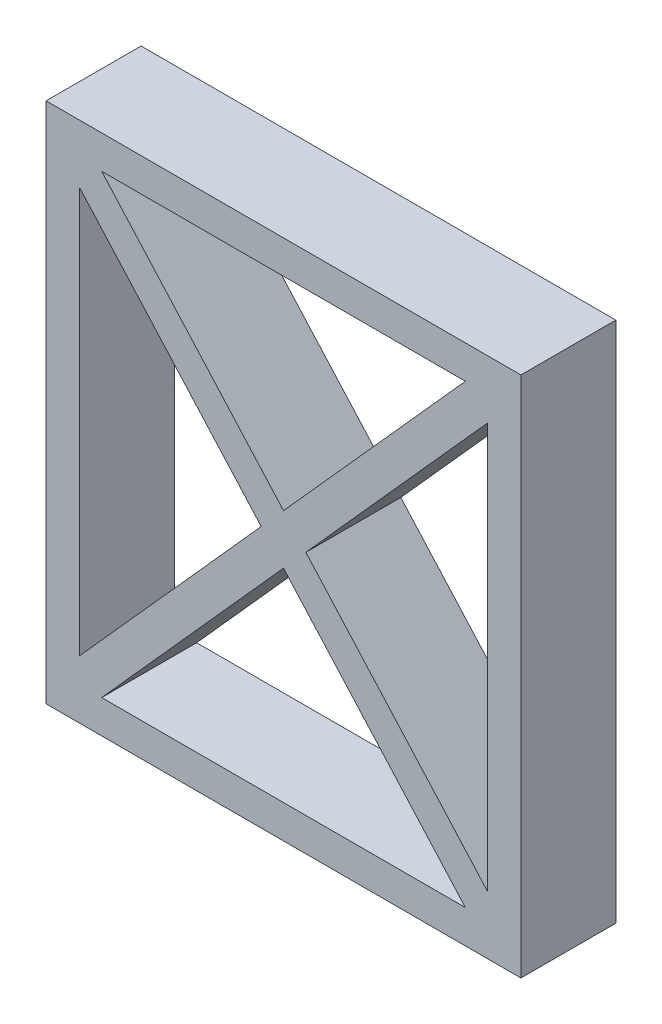
from build123d import *

# Parameters (mm, degrees)
SKIZZE1_W                       = 100
SKIZZE1_H                       = 110
AUFSATZ_LINEAR_AUSTRAGEN1_DEPTH = 20


with BuildPart() as part:
    # Skizze1 → Aufsatz-Linear austragen1 (new body)
    with BuildSketch(Plane.XY):
        with Locations((0, -55)):
            Rectangle(SKIZZE1_W, SKIZZE1_H)
        Polygon((-43, -12.24542346), (-43, -97.75457654), (-4.699025183, -55), align=None, mode=Mode.SUBTRACT)
        Polygon((-38.300974817, -103), (38.300974817, -103), (0, -60.24542346), align=None, mode=Mode.SUBTRACT)
        Polygon((43, -97.75457654), (43, -12.24542346), (4.699025183, -55), align=None, mode=Mode.SUBTRACT)
        Polygon((38.300974817, -7), (-38.300974817, -7), (0, -49.75457654), align=None, mode=Mode.SUBTRACT)
    extrude(amount=AUFSATZ_LINEAR_AUSTRAGEN1_DEPTH)


solid = part.part
